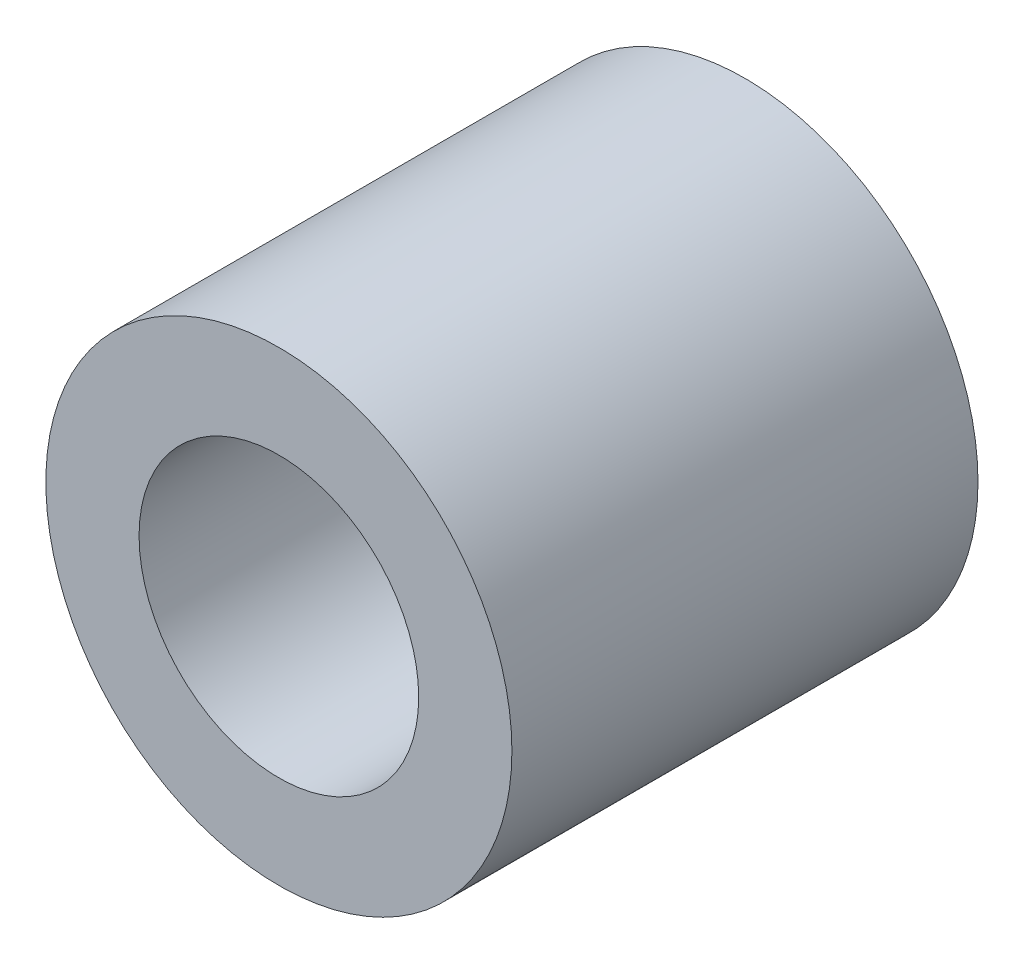
from build123d import *

# Parameters (mm, degrees)
SKETCH2_R           = 5
BOSS_EXTRUDE1_DEPTH = 10
CUT_EXTRUDE1_DEPTH  = 5
SKETCH4_R           = 3
CUT_EXTRUDE2_DEPTH  = 5


with BuildPart() as part:
    # Sketch2 → Boss-Extrude1 (new body)
    with BuildSketch(Plane.XY):
        Circle(SKETCH2_R)
    extrude(amount=BOSS_EXTRUDE1_DEPTH)

    # Sketch3 → Cut-Extrude1 (cut)
    with BuildSketch(Plane(origin=(0, 0, 0), x_dir=(-1, 0, 0), z_dir=(0, 0, -1))):
        with BuildLine():
            Line((1.908838778, 0.596937618), (0.830860529, -1.81925006))
            ThreePointArc((0.830860529, -1.81925006), (-1.826466205, 0.814874961), (1.908838778, 0.596937618))
        make_face()
    extrude(amount=-CUT_EXTRUDE1_DEPTH, mode=Mode.SUBTRACT)

    # Sketch4 → Cut-Extrude2 (cut)
    with BuildSketch(Plane.XY.offset(10)):
        Circle(SKETCH4_R)
    extrude(amount=-CUT_EXTRUDE2_DEPTH, mode=Mode.SUBTRACT)


solid = part.part
